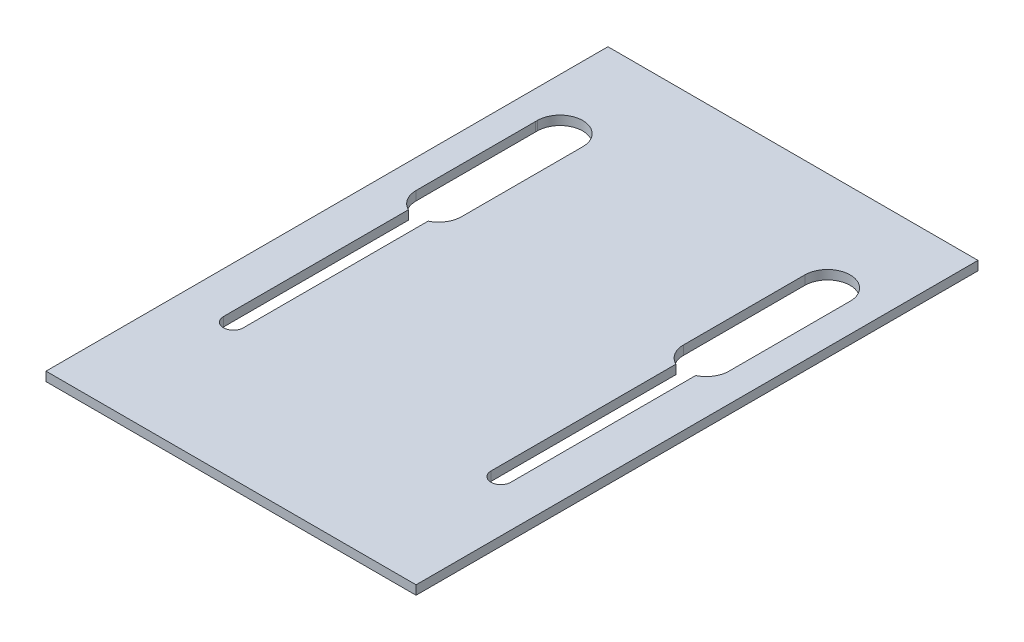
from build123d import *

# Parameters (mm, degrees)
SKETCH3_W           = 122.1
SKETCH3_H           = 197.8
BOSS_EXTRUDE2_DEPTH = 3
SKETCH4_R           = 7.5
CUT_EXTRUDE2_DEPTH  = 3
SKETCH5_W           = 185.639017853
SKETCH5_H           = 93.814581834
CUT_EXTRUDE3_DEPTH  = 12
SKETCH7_W           = 181.97184254
SKETCH7_H           = 161.609726855
CUT_EXTRUDE4_DEPTH  = 19
CUT_EXTRUDE8_DEPTH  = 10
SKETCH10_W          = 122.1
SKETCH10_H          = 3
BOSS_EXTRUDE3_DEPTH = 18.6


with BuildPart() as part:
    # Sketch3 → Boss-Extrude2 (new body)
    with BuildSketch(Plane(origin=(0, 0, 0), x_dir=(1, 0, 0), z_dir=(0, 1, 0))):
        with Locations((61.05, 98.9)):
            Rectangle(SKETCH3_W, SKETCH3_H)
    extrude(amount=BOSS_EXTRUDE2_DEPTH)

    # Sketch4 → Cut-Extrude2 (cut)
    with BuildSketch(Plane(origin=(0, 3, 0), x_dir=(1, 0, 0), z_dir=(0, 1, 0))):
        with Locations((16.92, 152.8)):
            Circle(SKETCH4_R)
        with Locations((105.18, 152.8)):
            Circle(SKETCH4_R)
        with BuildLine():
            Line((20.17, 145.3), (20.17, 45.3))
            ThreePointArc((20.17, 45.3), (16.92, 42.05), (13.67, 45.3))
            Line((13.67, 45.3), (13.67, 145.3))
            ThreePointArc((13.67, 145.3), (16.92, 148.55), (20.17, 145.3))
        make_face()
        with BuildLine():
            Line((101.93, 145.3), (101.93, 45.3))
            ThreePointArc((101.93, 45.3), (105.18, 42.05), (108.43, 45.3))
            Line((108.43, 45.3), (108.43, 145.3))
            ThreePointArc((108.43, 145.3), (105.18, 148.55), (101.93, 145.3))
        make_face()
    extrude(amount=-CUT_EXTRUDE2_DEPTH, mode=Mode.SUBTRACT)

    # Sketch5 → Cut-Extrude3 (cut)
    with BuildSketch(Plane(origin=(0, 0, -197.8), x_dir=(-1, 0, 0), z_dir=(0, 0, -1))):
        with Locations((-62.393879106, -6.143731482)):
            Rectangle(SKETCH5_W, SKETCH5_H)
    extrude(amount=-CUT_EXTRUDE3_DEPTH, mode=Mode.SUBTRACT)

    # Sketch7 → Cut-Extrude4 (cut)
    with BuildSketch(Plane.XY):
        with Locations((66.543858185, 9.384028943)):
            Rectangle(SKETCH7_W, SKETCH7_H)
    extrude(amount=-CUT_EXTRUDE4_DEPTH, mode=Mode.SUBTRACT)

    # Sketch8 → Cut-Extrude8 (cut)
    with BuildSketch(Plane(origin=(0, 3, 0), x_dir=(1, 0, 0), z_dir=(0, 1, 0))):
        with BuildLine():
            ThreePointArc((13.67, 106.308017417), (16.91951533, 105.565143685), (20.17, 106.303764471))
            Line((20.17, 106.303764471), (20.17, 145.3))
            ThreePointArc((20.17, 145.3), (20.150641933, 145.654193023), (20.09279834, 146.004166667))
            ThreePointArc((20.09279834, 146.004166667), (21.056311174, 159.056271243), (9.424422573, 153.057524837))
            Line((9.424422573, 153.057524837), (9.424422573, 152.542475163))
            ThreePointArc((9.424422573, 152.542475163), (10.663728757, 148.663688826), (13.74720166, 146.004166667))
            ThreePointArc((13.74720166, 146.004166667), (13.689358067, 145.654193023), (13.67, 145.3))
            Line((13.67, 145.3), (13.67, 106.308017417))
        make_face()
        with BuildLine():
            ThreePointArc((112.675577427, 153.06514208), (105.175577427, 160.56514208), (97.675577427, 153.06514208))
            Line((97.675577427, 153.06514208), (97.675577427, 113.06514208))
            ThreePointArc((97.675577427, 113.06514208), (98.827671051, 109.070885622), (101.93, 106.303764471))
            Line((101.93, 106.303764471), (101.93, 145.3))
            ThreePointArc((101.93, 145.3), (101.949358067, 145.654193023), (102.00720166, 146.004166667))
            ThreePointArc((102.00720166, 146.004166667), (101.043688826, 159.056271243), (112.675577427, 153.057524837))
            Line((112.675577427, 153.057524837), (112.675577427, 153.06514208))
        make_face()
        with BuildLine():
            Line((108.43, 145.3), (108.43, 106.308017417))
            ThreePointArc((108.43, 106.308017417), (111.526095882, 109.075039907), (112.675577427, 113.06514208))
            Line((112.675577427, 113.06514208), (112.675577427, 152.542475163))
            ThreePointArc((112.675577427, 152.542475163), (111.436271243, 148.663688826), (108.35279834, 146.004166667))
            ThreePointArc((108.35279834, 146.004166667), (108.410641933, 145.654193023), (108.43, 145.3))
        make_face()
        with BuildLine():
            ThreePointArc((9.424422573, 113.06514208), (10.573904118, 109.075039907), (13.67, 106.308017417))
            Line((13.67, 106.308017417), (13.67, 145.3))
            ThreePointArc((13.67, 145.3), (13.689358067, 145.654193023), (13.74720166, 146.004166667))
            ThreePointArc((13.74720166, 146.004166667), (10.663728757, 148.663688826), (9.424422573, 152.542475163))
            Line((9.424422573, 152.542475163), (9.424422573, 113.06514208))
        make_face()
        with BuildLine():
            Line((24.424422573, 113.06514208), (24.424422573, 153.06514208))
            ThreePointArc((24.424422573, 153.06514208), (16.924422573, 160.56514208), (9.424422573, 153.06514208))
            Line((9.424422573, 153.06514208), (9.424422573, 153.057524837))
            ThreePointArc((9.424422573, 153.057524837), (21.056311174, 159.056271243), (20.09279834, 146.004166667))
            ThreePointArc((20.09279834, 146.004166667), (20.150641933, 145.654193023), (20.17, 145.3))
            Line((20.17, 145.3), (20.17, 106.303764471))
            ThreePointArc((20.17, 106.303764471), (23.272328949, 109.070885622), (24.424422573, 113.06514208))
        make_face()
    extrude(amount=-CUT_EXTRUDE8_DEPTH, mode=Mode.SUBTRACT)

    # Sketch10 → Boss-Extrude3 (add)
    with BuildSketch(Plane.XY.offset(-19)):
        with Locations((61.05, 1.5)):
            Rectangle(SKETCH10_W, SKETCH10_H)
    extrude(amount=BOSS_EXTRUDE3_DEPTH)


solid = part.part
